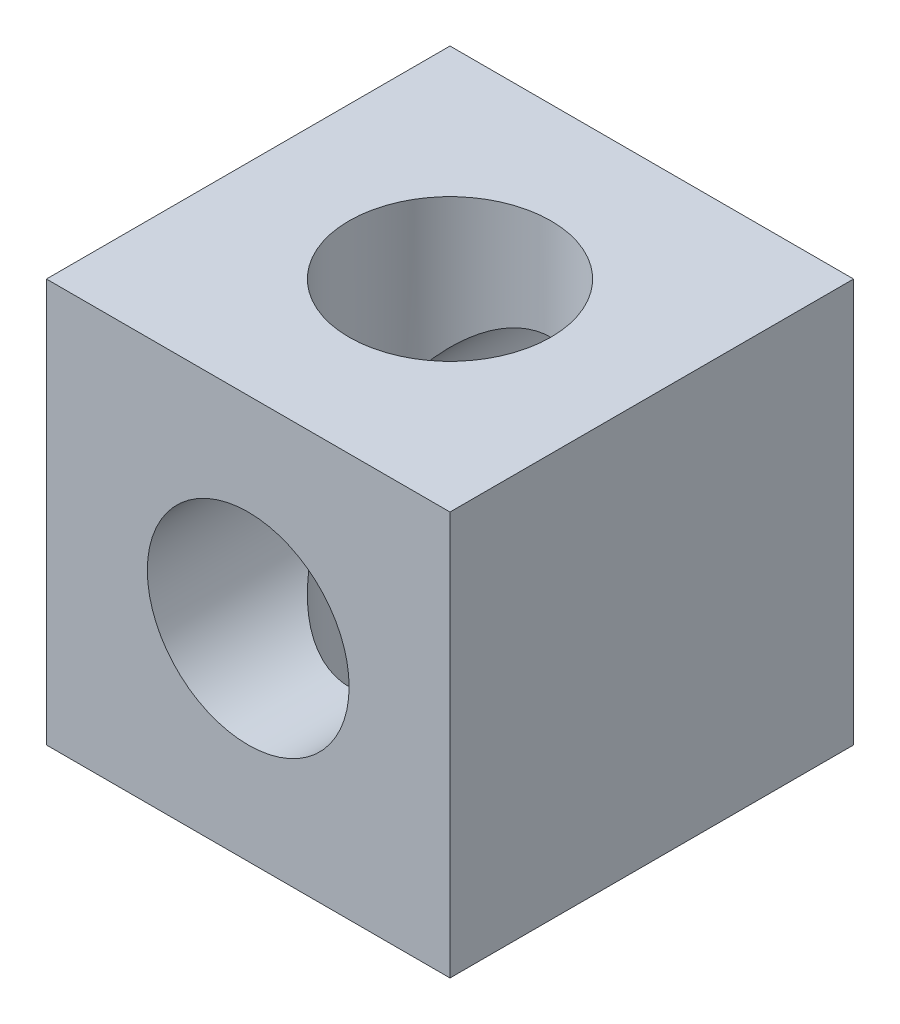
from build123d import *

# Parameters (mm, degrees)
SKETCH_1_W          = 8
SKETCH_1_H          = 8
EXTRUDE_1_DEPTH     = 8
SKETCH_2_R          = 2
CUT_EXTRUDE_1_DEPTH = 22
SKETCH_3_R          = 2
CUT_EXTRUDE_2_DEPTH = 22


with BuildPart() as part:
    # 草图1 → 拉伸1 (new body)
    with BuildSketch(Plane.XY):
        Rectangle(SKETCH_1_W, SKETCH_1_H)
    extrude(amount=EXTRUDE_1_DEPTH)

    # 草图2 → 切除-拉伸1 (cut)
    with BuildSketch(Plane.XY.offset(8)):
        Circle(SKETCH_2_R)
    extrude(amount=-CUT_EXTRUDE_1_DEPTH, mode=Mode.SUBTRACT)

    # 草图3 → 切除-拉伸2 (cut)
    with BuildSketch(Plane(origin=(0, 4, 0), x_dir=(-1, 0, 0), z_dir=(0, 1, 0))):
        with Locations(Location((0, 4, 0), (0, 0, 90))):
            Circle(SKETCH_3_R)
    extrude(amount=-CUT_EXTRUDE_2_DEPTH, mode=Mode.SUBTRACT)


solid = part.part
